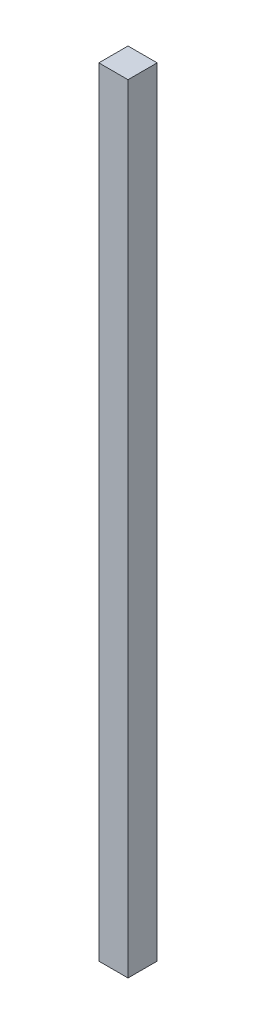
from build123d import *

# Parameters (mm, degrees)
SKETCH4_W           = 15
SKETCH4_H           = 15
BOSS_EXTRUDE2_DEPTH = 400


with BuildPart() as part:
    # Sketch4 → Boss-Extrude2 (new body)
    with BuildSketch(Plane(origin=(0, 0, 0), x_dir=(1, 0, 0), z_dir=(0, 1, 0))):
        with Locations((7.5, 7.5)):
            Rectangle(SKETCH4_W, SKETCH4_H)
    extrude(amount=BOSS_EXTRUDE2_DEPTH)


solid = part.part
